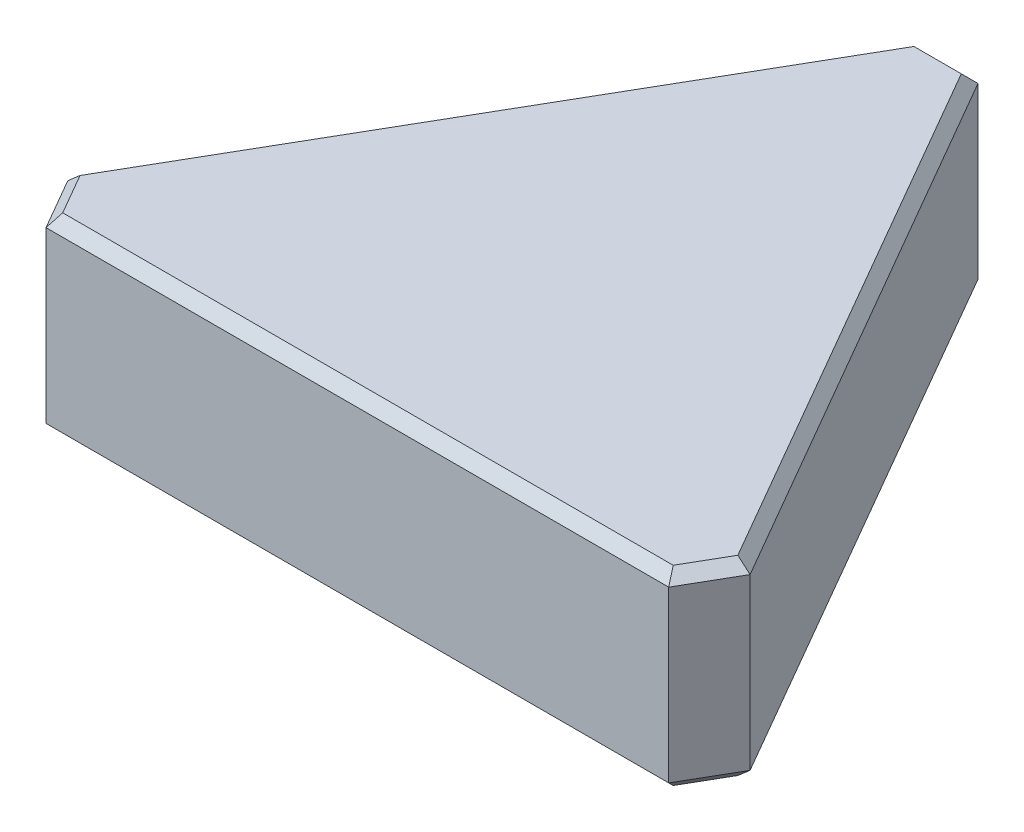
from build123d import *

# Parameters (mm, degrees)
BOSS_EXTRU_1_DEPTH     = 36
CHANFREIN1_SIZE        = 11.24
CHANFREIN1_EDGE_2_SIZE = 11.24
CHANFREIN1_EDGE_3_SIZE = 11.24
CHANFREIN2_SIZE        = 2
CHANFREIN3_SIZE        = 2


with BuildPart() as part:
    # Esquisse1 → Boss.-Extru.1 (new body)
    with BuildSketch(Plane(origin=(0, 0, 0), x_dir=(1, 0, 0), z_dir=(0, 1, 0))):
        Polygon((-70, 0), (70, 0), (0, 121.24355653), align=None)
    extrude(amount=BOSS_EXTRU_1_DEPTH)

    # Chanfrein1
    chanfrein1_edges = [part.edges().sort_by_distance(p)[0] for p in [
        (70, 18, 0),
    ]]
    chamfer(chanfrein1_edges, length=CHANFREIN1_SIZE)

    # Chanfrein1 edge 2
    chanfrein1_edge_2_edges = [part.edges().sort_by_distance(p)[0] for p in [
        (-70, 18, 0),
    ]]
    chamfer(chanfrein1_edge_2_edges, length=CHANFREIN1_EDGE_2_SIZE)

    # Chanfrein1 edge 3
    chanfrein1_edge_3_edges = [part.edges().sort_by_distance(p)[0] for p in [
        (0, 18, -121.24355653),
    ]]
    chamfer(chanfrein1_edge_3_edges, length=CHANFREIN1_EDGE_3_SIZE)

    # Chanfrein2
    chanfrein2_edges = [part.edges().sort_by_distance(p)[0] for p in [
        (0, 36, 0),
        (-35, 36, -60.621778265),
        (35, 36, -60.621778265),
        (61.57, 36, -4.867062769),
        (0, 36, -111.509430991),
        (-61.57, 36, -4.867062769),
    ]]
    chamfer(chanfrein2_edges, length=CHANFREIN2_SIZE)

    # Chanfrein3
    chanfrein3_edges = [part.edges().sort_by_distance(p)[0] for p in [
        (0, 0, 0),
        (35, 0, -60.621778265),
        (-35, 0, -60.621778265),
        (61.57, 0, -4.867062769),
        (0, 0, -111.509430991),
        (-61.57, 0, -4.867062769),
    ]]
    chamfer(chanfrein3_edges, length=CHANFREIN3_SIZE)


solid = part.part
